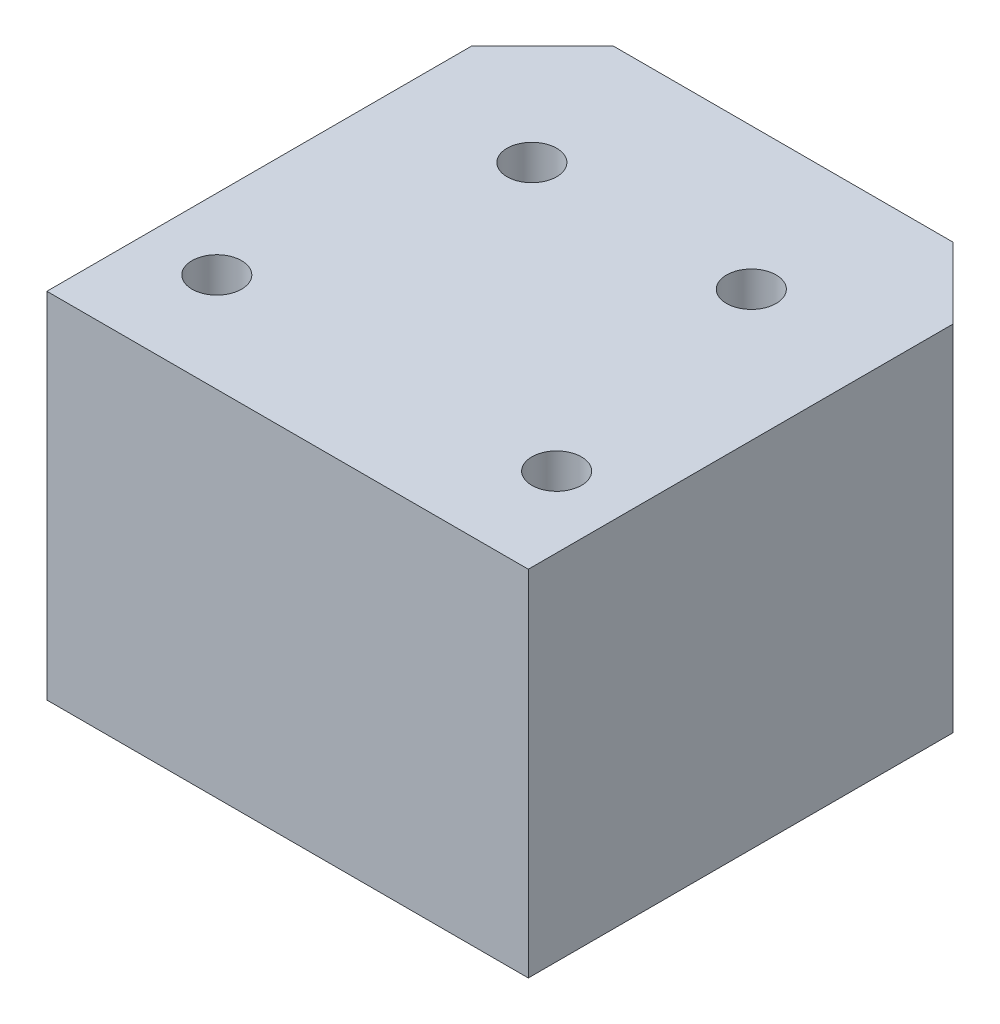
from build123d import *

# Parameters (mm, degrees)
SKETCH1_W          = 34
SKETCH1_H          = 25
EXTRUDE1_DEPTH     = 30
SKETCH2_W          = 34
SKETCH2_H          = 25
EXTRUDE2_DEPTH     = 5
CHAMFER1_SIZE      = 5
SKETCH3_R          = 1.75
CUT_EXTRUDE1_DEPTH = 47.717707411


with BuildPart() as part:
    # Sketch1 → Extrude1 (new body)
    with BuildSketch(Plane.XY):
        with Locations((-8.642624393, 54.051188485)):
            Rectangle(SKETCH1_W, SKETCH1_H)
    extrude(amount=-EXTRUDE1_DEPTH)

    # Sketch2 → Extrude2 (add)
    with BuildSketch(Plane.XY):
        with Locations((-8.642624393, 54.051188485)):
            Rectangle(SKETCH2_W, SKETCH2_H)
    extrude(amount=EXTRUDE2_DEPTH)

    # Chamfer1
    chamfer1_edges = [part.edges().sort_by_distance(p)[0] for p in [
        (8.357375607, 54.051188485, -30),
        (-25.642624393, 54.051188485, -30),
    ]]
    chamfer(chamfer1_edges, length=CHAMFER1_SIZE)

    # Sketch3 → Cut-Extrude1 (cut, through all)
    with BuildSketch(Plane.XZ.offset(-41.551188485)):
        with Locations((-16.392624393, -20)):
            Circle(SKETCH3_R)
        with Locations((-0.892624393, -20)):
            Circle(SKETCH3_R)
        with Locations((-20.642624393, -2)):
            Circle(SKETCH3_R)
        with Locations(Location((3.357375607, -2, 0), (0, 0, 180))):
            Circle(SKETCH3_R)
    extrude(amount=-CUT_EXTRUDE1_DEPTH, mode=Mode.SUBTRACT)


solid = part.part
